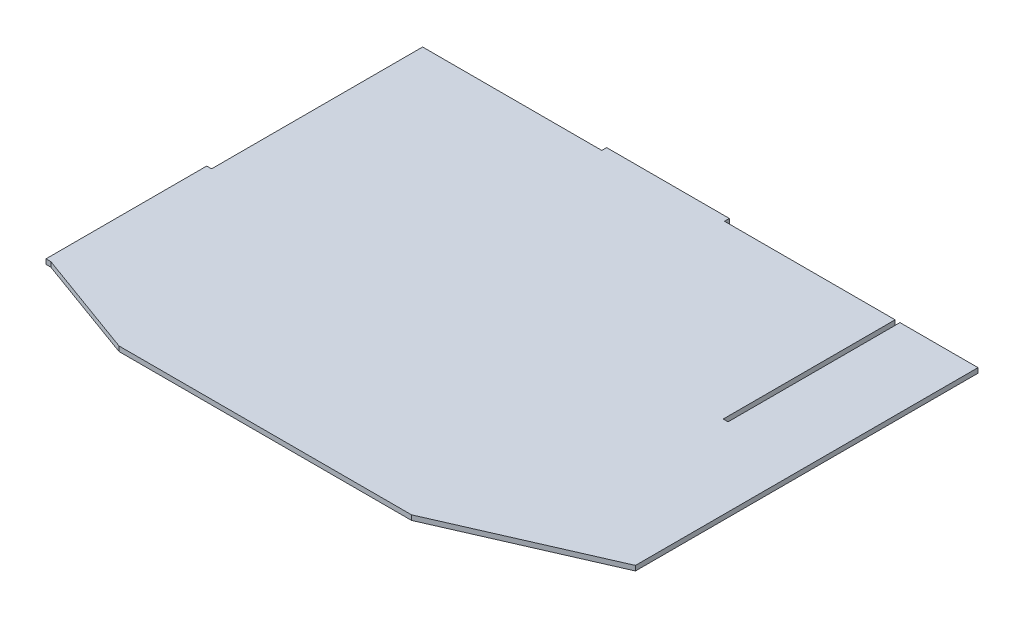
from build123d import *

# Parameters (mm, degrees)
SKETCH1_W           = 308.11216
SKETCH1_H           = 3.175
BOSS_EXTRUDE1_DEPTH = 267.83
SKETCH3_W           = 155.702
SKETCH3_H           = 3.175
BOSS_EXTRUDE3_DEPTH = 3.175
SKETCH4_W           = 50.87366
SKETCH4_H           = 3.175
BOSS_EXTRUDE4_DEPTH = 267.83
CUT_EXTRUDE1_DEPTH  = 340.191055801
SKETCH8_W           = 80
SKETCH8_H           = 3.175
BOSS_EXTRUDE6_DEPTH = 3.175
CUT_EXTRUDE3_DEPTH  = 340.191055801
SKETCH13_W          = 104.779999964
SKETCH13_H          = 3.1854967
BOSS_EXTRUDE7_DEPTH = 3.175


with BuildPart() as part:
    # Sketch1 → Boss-Extrude1 (new body)
    with BuildSketch(Plane.XY):
        Rectangle(SKETCH1_W, SKETCH1_H)
    extrude(amount=BOSS_EXTRUDE1_DEPTH)

    # Sketch3 → Boss-Extrude3 (add)
    with BuildSketch(Plane(origin=(154.05608, 0, 0), x_dir=(0, 0, -1), z_dir=(1, 0, 0))):
        with Locations((-189.979, 0)):
            Rectangle(SKETCH3_W, SKETCH3_H)
    extrude(amount=BOSS_EXTRUDE3_DEPTH)

    # Sketch4 → Boss-Extrude4 (add)
    with BuildSketch(Plane.XY.offset(267.83)):
        with Locations((182.66791, 0)):
            Rectangle(SKETCH4_W, SKETCH4_H)
    extrude(amount=-BOSS_EXTRUDE4_DEPTH)

    # Sketch6 → Cut-Extrude1 (cut, through all)
    with BuildSketch(Plane(origin=(0, 1.5875, 0), x_dir=(1, 0, 0), z_dir=(0, 1, 0))):
        Polygon((208.10474, -223.38), (106.50474, -267.83), (208.10474, -267.83), align=None)
    extrude(amount=-CUT_EXTRUDE1_DEPTH, mode=Mode.SUBTRACT)

    # Sketch8 → Boss-Extrude6 (add)
    with BuildSketch(Plane(origin=(0, 0, 0), x_dir=(-1, 0, 0), z_dir=(0, 0, -1))):
        with Locations((-2.78399998, 0)):
            Rectangle(SKETCH8_W, SKETCH8_H)
    extrude(amount=BOSS_EXTRUDE6_DEPTH)

    # Sketch11 → Cut-Extrude3 (cut, through all)
    with BuildSketch(Plane.XZ.offset(1.5875)):
        Polygon((-154.05608, 242.43), (-84.20608, 267.83), (-154.05608, 267.83), align=None)
    extrude(amount=-CUT_EXTRUDE3_DEPTH, mode=Mode.SUBTRACT)

    # Sketch13 → Boss-Extrude7 (add)
    with BuildSketch(Plane.ZY.offset(154.05608)):
        with Locations((190.040000018, -0.00524835)):
            Rectangle(SKETCH13_W, SKETCH13_H)
    extrude(amount=BOSS_EXTRUDE7_DEPTH)


solid = part.part
